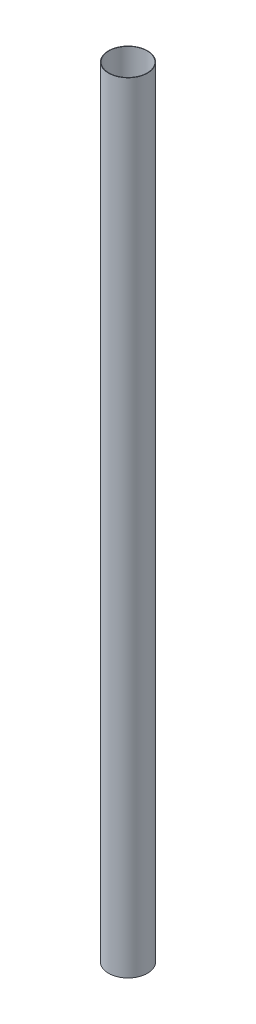
from build123d import *

# Parameters (mm, degrees)
SKETCH_1_R      = 2.5
SKETCH_1_R_2    = 2.45
EXTRUDE_1_DEPTH = 100


with BuildPart() as part:
    # 草圖1 → 填料-伸長1 (new body)
    with BuildSketch(Plane(origin=(0, 0, 0), x_dir=(1, 0, 0), z_dir=(0, 1, 0))):
        with Locations(Location((0, 0, 0), (0, 0, 270))):
            Circle(SKETCH_1_R)
        with Locations(Location((0, 0, 0), (0, 0, 270))):
            Circle(SKETCH_1_R_2, mode=Mode.SUBTRACT)
    extrude(amount=EXTRUDE_1_DEPTH)


solid = part.part
